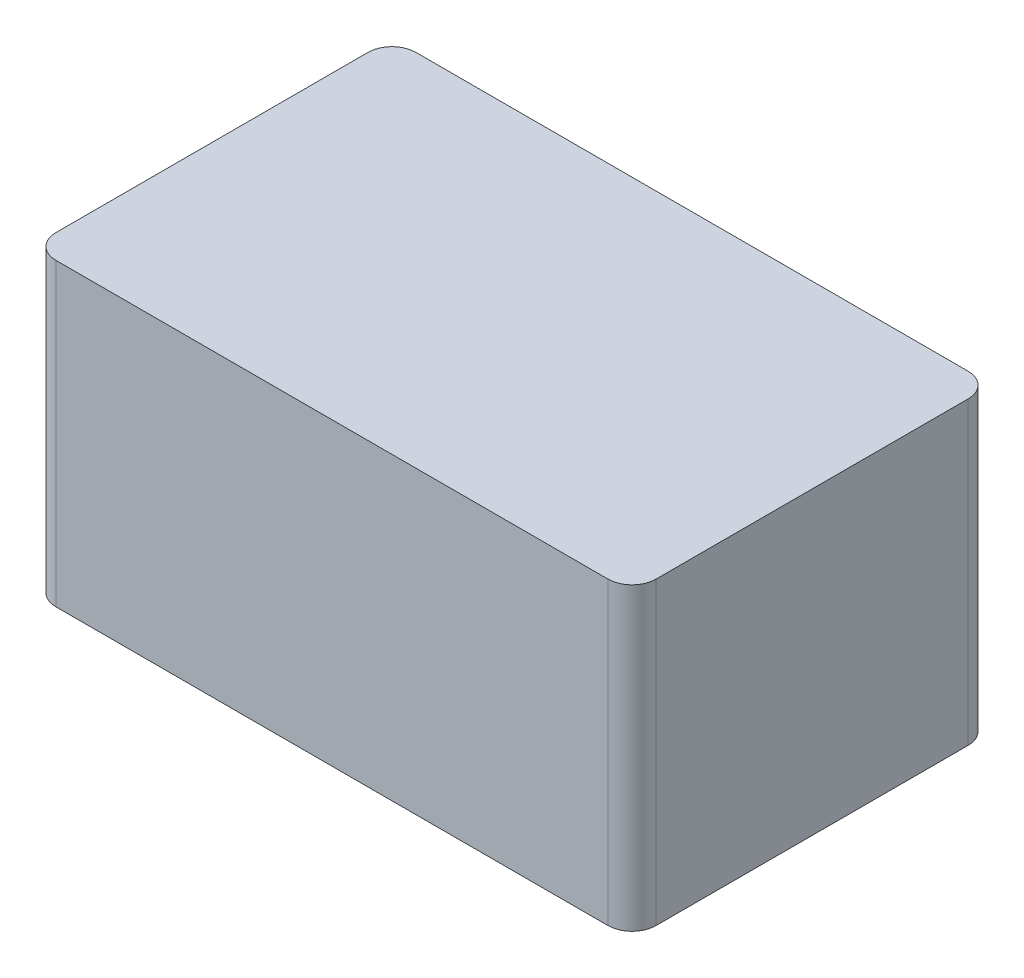
from build123d import *

# Parameters (mm, degrees)
SKETCH_1_W      = 50
SKETCH_1_H      = 30
EXTRUDE_1_DEPTH = 25
FILLET_1_R      = 2


with BuildPart() as part:
    # 草图1 → 凸台-拉伸1 (new body)
    with BuildSketch(Plane(origin=(0, 0, 0), x_dir=(1, 0, 0), z_dir=(0, 1, 0))):
        Rectangle(SKETCH_1_W, SKETCH_1_H)
    extrude(amount=EXTRUDE_1_DEPTH)

    # 圆角1
    fillet_1_edges = [part.edges().sort_by_distance(p)[0] for p in [
        (-25, 12.5, -15),
        (25, 12.5, -15),
        (25, 12.5, 15),
        (-25, 12.5, 15),
    ]]
    fillet(fillet_1_edges, radius=FILLET_1_R)


solid = part.part
